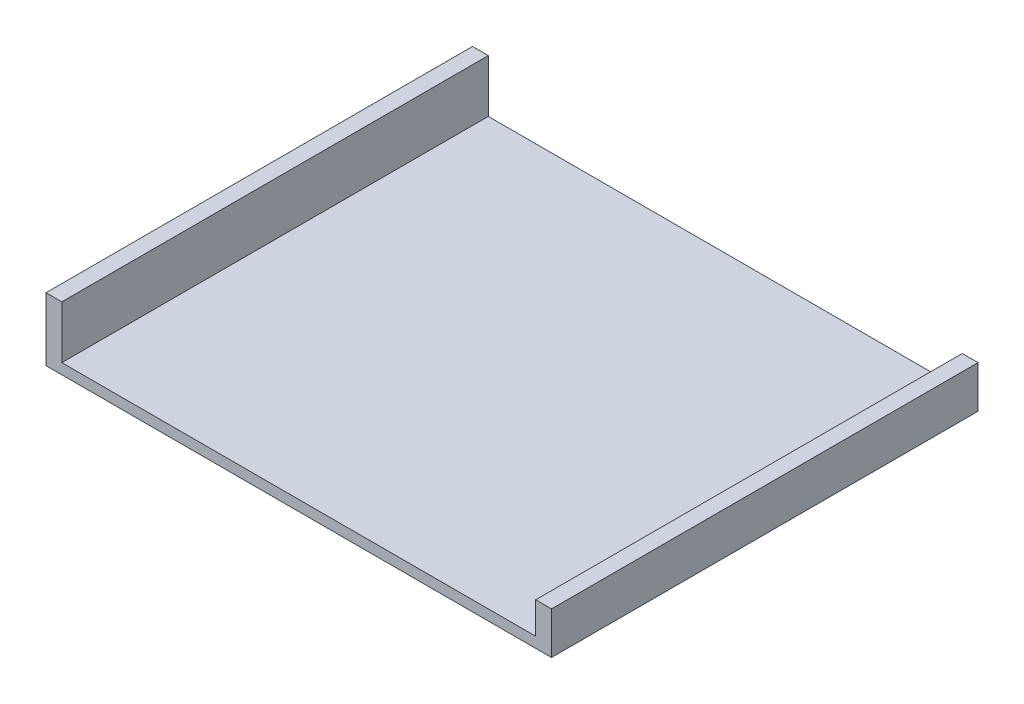
from build123d import *

# Parameters (mm, degrees)
SK_P01_TRAY_W      = 96
SK_P01_TRAY_H      = 81
P01_TRAY_DEPTH     = 2
P02_REARSTOP_START = 2
SK_P02_REARSTOP_W  = 3
SK_P02_REARSTOP_H  = 81
P02_REARSTOP_DEPTH = 10
P03_FRONTLIP_START = 2
SK_P03_FRONTLIP_W  = 3
SK_P03_FRONTLIP_H  = 81
P03_FRONTLIP_DEPTH = 6


with BuildPart() as part:
    # SK_P01_Tray → P01_Tray (new body)
    with BuildSketch(Plane(origin=(0, 0, 0), x_dir=(1, 0, 0), z_dir=(0, 1, 0))):
        Rectangle(SK_P01_TRAY_W, SK_P01_TRAY_H)
    extrude(amount=P01_TRAY_DEPTH)

    # SK_P02_Rearstop → P02_Rearstop (add)
    with BuildSketch(Plane(origin=(0, 0, 0), x_dir=(1, 0, 0), z_dir=(0, 1, 0)).offset(P02_REARSTOP_START)):
        with Locations((-46.5, 0)):
            Rectangle(SK_P02_REARSTOP_W, SK_P02_REARSTOP_H)
    extrude(amount=P02_REARSTOP_DEPTH)

    # SK_P03_Frontlip → P03_Frontlip (add)
    with BuildSketch(Plane(origin=(0, 0, 0), x_dir=(1, 0, 0), z_dir=(0, 1, 0)).offset(P03_FRONTLIP_START)):
        with Locations((46.5, 0)):
            Rectangle(SK_P03_FRONTLIP_W, SK_P03_FRONTLIP_H)
    extrude(amount=P03_FRONTLIP_DEPTH)


solid = part.part
